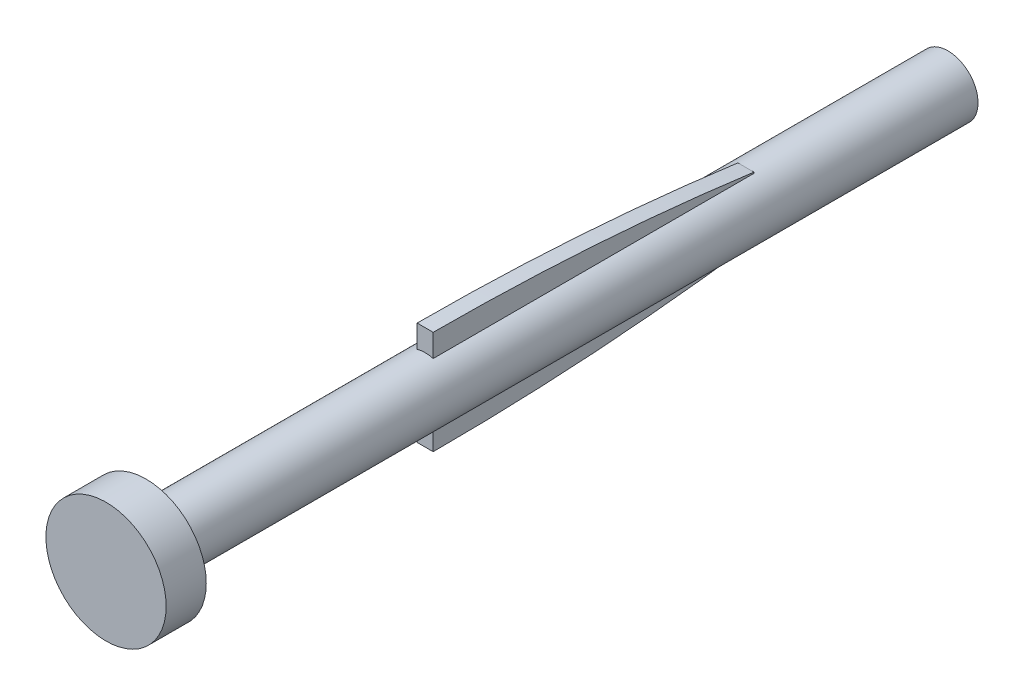
from build123d import *

# Parameters (mm, degrees)
SKETCH1_R                = 9.525
BOSS_EXTRUDE1_DEPTH      = 6.35
SKETCH2_R                = 4.7625
BOSS_EXTRUDE2_DEPTH      = 127
BOSS_EXTRUDE3_DEPTH      = 1.27
BOSS_EXTRUDE3_DEPTH_BACK = 1.27


with BuildPart() as part:
    # Sketch1 → Boss-Extrude1 (new body)
    with BuildSketch(Plane.XY):
        Circle(SKETCH1_R)
    extrude(amount=BOSS_EXTRUDE1_DEPTH)

    # Sketch2 → Boss-Extrude2 (add)
    with BuildSketch(Plane(origin=(0, 0, 0), x_dir=(-1, 0, 0), z_dir=(0, 0, -1))):
        Circle(SKETCH2_R)
    extrude(amount=BOSS_EXTRUDE2_DEPTH)

    # Sketch3 → Boss-Extrude3 (add, two sides: drawn at the far end of the back side and taken through both)
    with BuildSketch(Plane(origin=(0, 0, 0), x_dir=(0, 0, -1), z_dir=(1, 0, 0)).offset(-BOSS_EXTRUDE3_DEPTH_BACK)):
        with BuildLine():
            Line((44.196, -4.7625), (44.196, 4.7625))
            Line((44.196, 4.7625), (44.196, 8.1915))
            ThreePointArc((44.196, 8.1915), (69.653798614, 7.333275757), (94.996, 4.7625))
            Line((94.996, 4.7625), (94.996, -4.7625))
            ThreePointArc((94.996, -4.7625), (69.653798614, -7.333275757), (44.196, -8.1915))
            Line((44.196, -8.1915), (44.196, -4.7625))
        make_face()
    extrude(amount=BOSS_EXTRUDE3_DEPTH + BOSS_EXTRUDE3_DEPTH_BACK)


solid = part.part
